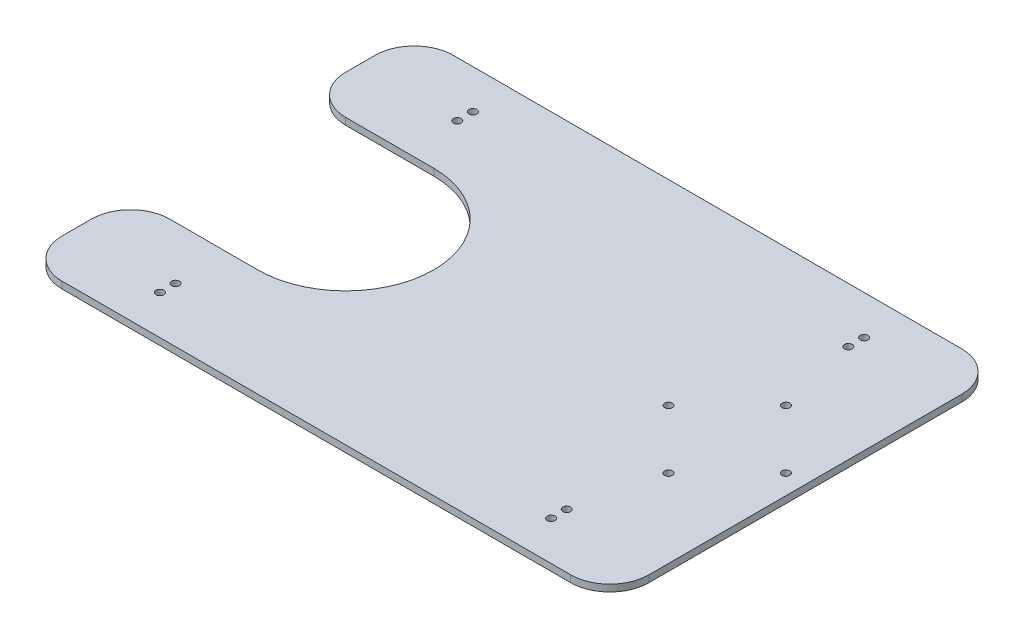
from build123d import *

# Parameters (mm, degrees)
SKETCH1_R           = 2
BOSS_EXTRUDE1_DEPTH = 1.75
FILLET1_R           = 20


with BuildPart() as part:
    # Sketch1 → Boss-Extrude1 (new, symmetric)
    with BuildSketch(Plane(origin=(0, 0, 0), x_dir=(1, 0, 0), z_dir=(0, 1, 0))):
        with BuildLine():
            Line((-150, 100), (-150, 45))
            Line((-150, 45), (-85, 45))
            ThreePointArc((-85, 45), (-40, 0), (-85, -45))
            Line((-85, -45), (-150, -45))
            Line((-150, -45), (-150, -100))
            Line((-150, -100), (150, -100))
            Line((150, -100), (150, 100))
            Line((150, 100), (-150, 100))
        make_face()
        with Locations(Location((-100, 80, 0), (0, 0, 270))):
            Circle(SKETCH1_R, mode=Mode.SUBTRACT)
        with Locations(Location((100, 80, 0), (0, 0, 270))):
            Circle(SKETCH1_R, mode=Mode.SUBTRACT)
        with Locations(Location((100, -80, 0), (0, 0, 270))):
            Circle(SKETCH1_R, mode=Mode.SUBTRACT)
        with Locations(Location((-100, -80, 0), (0, 0, 270))):
            Circle(SKETCH1_R, mode=Mode.SUBTRACT)
        with Locations(Location((-100, 72, 0), (0, 0, 270))):
            Circle(SKETCH1_R, mode=Mode.SUBTRACT)
        with Locations(Location((100, 72, 0), (0, 0, 270))):
            Circle(SKETCH1_R, mode=Mode.SUBTRACT)
        with Locations(Location((100, -72, 0), (0, 0, 270))):
            Circle(SKETCH1_R, mode=Mode.SUBTRACT)
        with Locations(Location((-100, -72, 0), (0, 0, 270))):
            Circle(SKETCH1_R, mode=Mode.SUBTRACT)
        with Locations(Location((110, 30, 0), (0, 0, 270))):
            Circle(SKETCH1_R, mode=Mode.SUBTRACT)
        with Locations(Location((140, 0, 0), (0, 0, 270))):
            Circle(SKETCH1_R, mode=Mode.SUBTRACT)
        with Locations(Location((110, -30, 0), (0, 0, 270))):
            Circle(SKETCH1_R, mode=Mode.SUBTRACT)
        with Locations(Location((80, 0, 0), (0, 0, 270))):
            Circle(SKETCH1_R, mode=Mode.SUBTRACT)
    extrude(amount=BOSS_EXTRUDE1_DEPTH, both=True)

    # Fillet1
    fillet1_edges = [part.edges().sort_by_distance(p)[0] for p in [
        (150, 0, 100),
        (-150, 0, 100),
        (-150, 0, 45),
        (-150, 0, -45),
        (-150, 0, -100),
        (150, 0, -100),
    ]]
    fillet(fillet1_edges, radius=FILLET1_R)


solid = part.part
